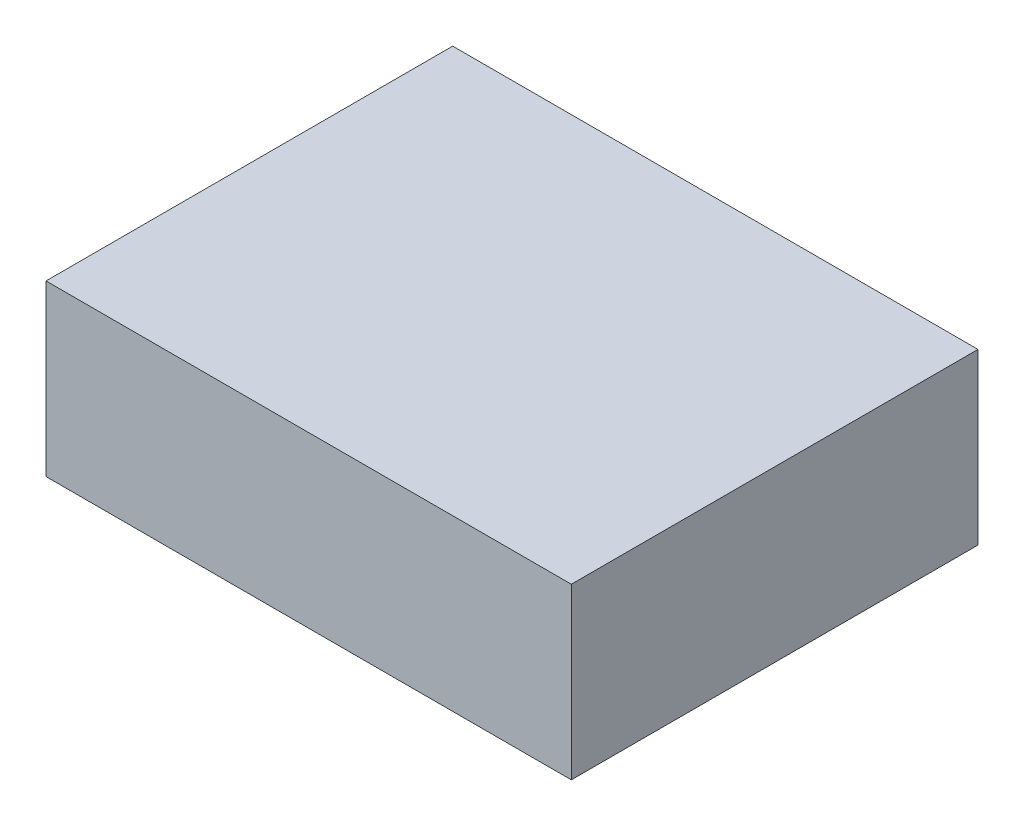
from build123d import *

# Parameters (mm, degrees)
SKETCH1_W           = 310
SKETCH1_H           = 240
BOSS_EXTRUDE1_DEPTH = 100


with BuildPart() as part:
    # Sketch1 → Boss-Extrude1 (new body)
    with BuildSketch(Plane(origin=(0, 0, 0), x_dir=(1, 0, 0), z_dir=(0, 1, 0))):
        Rectangle(SKETCH1_W, SKETCH1_H)
    extrude(amount=BOSS_EXTRUDE1_DEPTH)


solid = part.part
